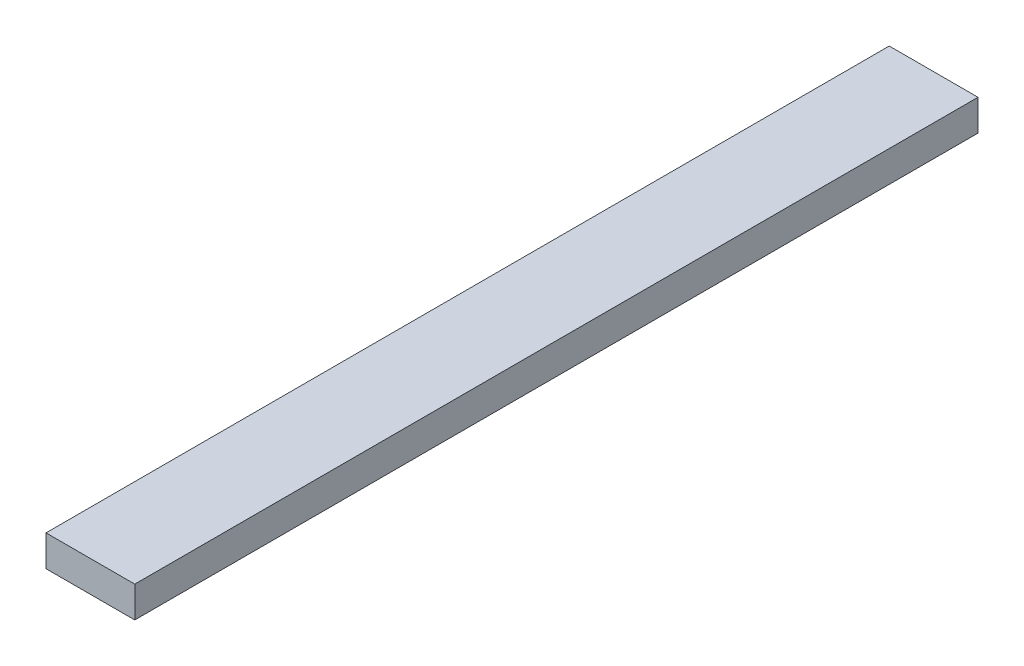
from build123d import *

# Parameters (mm, degrees)
CROQUIS1_W              = 20
CROQUIS1_H              = 190
SALIENTE_EXTRUIR1_DEPTH = 7


with BuildPart() as part:
    # Croquis1 → Saliente-Extruir1 (new body)
    with BuildSketch(Plane(origin=(0, 0, 0), x_dir=(1, 0, 0), z_dir=(0, 1, 0))):
        with Locations((10, 95)):
            Rectangle(CROQUIS1_W, CROQUIS1_H)
    extrude(amount=SALIENTE_EXTRUIR1_DEPTH)


solid = part.part
